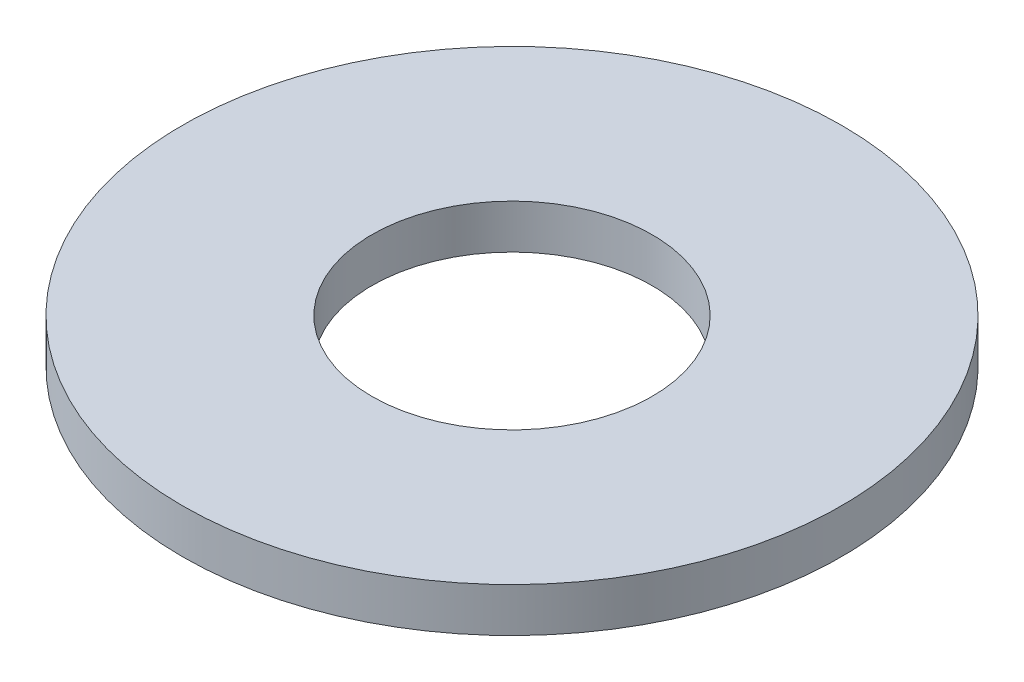
from build123d import *

# Parameters (mm, degrees)
SKETCH1_R           = 1.94
SKETCH1_R_2         = 0.825
BOSS_EXTRUDE1_DEPTH = 0.26


with BuildPart() as part:
    # Sketch1 → Boss-Extrude1 (new body)
    with BuildSketch(Plane(origin=(0, 0, 0), x_dir=(1, 0, 0), z_dir=(0, 1, 0))):
        with Locations(Location((0, 0, 0), (0, 0, 270))):
            Circle(SKETCH1_R)
        with Locations(Location((0, 0, 0), (0, 0, 270))):
            Circle(SKETCH1_R_2, mode=Mode.SUBTRACT)
    extrude(amount=BOSS_EXTRUDE1_DEPTH)


solid = part.part
